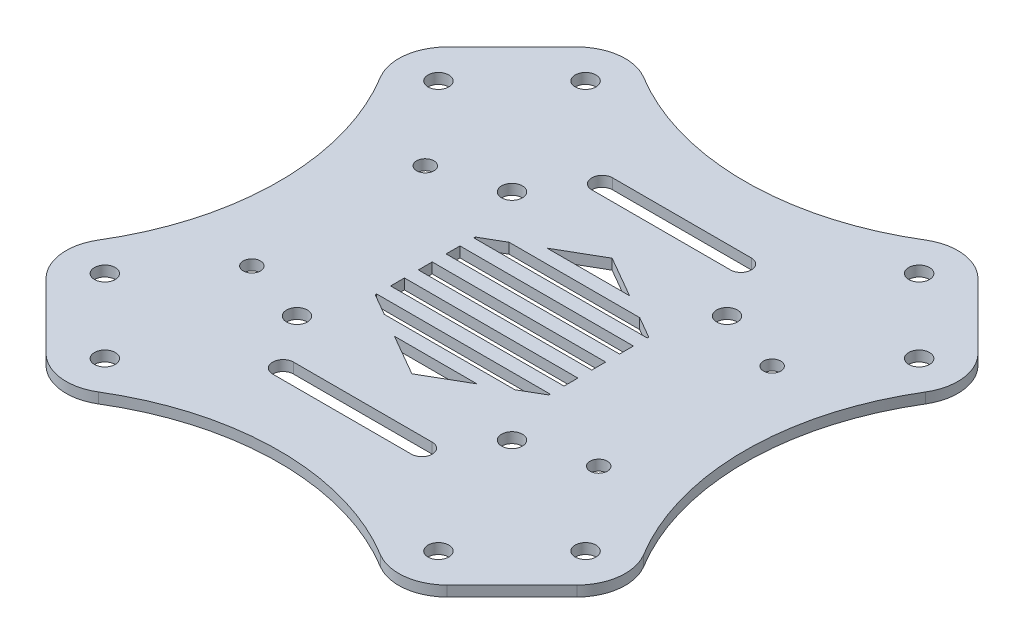
from build123d import *

# Parameters (mm, degrees)
BOSS_EXTRUDE1_DEPTH = 1.5
SKETCH2_R           = 1.5
CUT_EXTRUDE1_DEPTH  = 108.510464607
FILLET1_R           = 7
SKETCH3_R           = 1.5
CUT_EXTRUDE2_DEPTH  = 105.519616835
SKETCH6_R           = 1.25
CUT_EXTRUDE3_DEPTH  = 105.519616835
SKETCH8_W           = 25
SKETCH8_H           = 2
BOSS_EXTRUDE2_DEPTH = 1.5


with BuildPart() as part:
    # Sketch1 → Boss-Extrude1 (new body)
    with BuildSketch(Plane(origin=(0, 0, 0), x_dir=(1, 0, 0), z_dir=(0, 1, 0))):
        with BuildLine():
            Line((76.013978978, 8.838834765), (58.336309448, -8.838834765))
            ThreePointArc((58.336309448, -8.838834765), (33.587572106, 0), (8.838834765, -8.838834765))
            Line((8.838834765, -8.838834765), (-8.838834765, 8.838834765))
            ThreePointArc((-8.838834765, 8.838834765), (0, 33.587572106), (-8.838834765, 58.336309448))
            Line((-8.838834765, 58.336309448), (8.838834765, 76.013978978))
            ThreePointArc((8.838834765, 76.013978978), (33.587572106, 67.175144213), (58.336309448, 76.013978978))
            Line((58.336309448, 76.013978978), (76.013978978, 58.336309448))
            ThreePointArc((76.013978978, 58.336309448), (67.175144213, 33.587572106), (76.013978978, 8.838834765))
        make_face()
    extrude(amount=BOSS_EXTRUDE1_DEPTH)

    # Sketch2 → Cut-Extrude1 (cut, through all)
    with BuildSketch(Plane(origin=(0, 1.5, 0), x_dir=(1, 0, 0), z_dir=(0, 1, 0))):
        with Locations(Location((57.629202667, 68.235804385, 0), (0, 0, 270))):
            Circle(SKETCH2_R)
        with Locations(Location((68.235804385, 57.629202667, 0), (0, 0, 270))):
            Circle(SKETCH2_R)
        with Locations(Location((68.235804385, 9.545941546, 0), (0, 0, 270))):
            Circle(SKETCH2_R)
        with Locations(Location((57.629202667, -1.060660172, 0), (0, 0, 270))):
            Circle(SKETCH2_R)
        with Locations(Location((9.545941546, -1.060660172, 0), (0, 0, 270))):
            Circle(SKETCH2_R)
        with Locations(Location((-1.060660172, 9.545941546, 0), (0, 0, 270))):
            Circle(SKETCH2_R)
        with Locations(Location((-1.060660172, 57.629202667, 0), (0, 0, 270))):
            Circle(SKETCH2_R)
        with Locations(Location((9.545941546, 68.235804385, 0), (0, 0, 270))):
            Circle(SKETCH2_R)
    extrude(amount=-CUT_EXTRUDE1_DEPTH, mode=Mode.SUBTRACT)

    # Fillet1
    fillet1_edges = [part.edges().sort_by_distance(p)[0] for p in [
        (76.013978978, 0.75, -8.838834765),
        (58.336309448, 0.75, 8.838834765),
        (8.838834765, 0.75, 8.838834765),
        (-8.838834765, 0.75, -8.838834765),
        (-8.838834765, 0.75, -58.336309448),
        (8.838834765, 0.75, -76.013978978),
        (58.336309448, 0.75, -76.013978978),
        (76.013978978, 0.75, -58.336309448),
    ]]
    fillet(fillet1_edges, radius=FILLET1_R)

    # Sketch3 → Cut-Extrude2 (cut, through all)
    with BuildSketch(Plane(origin=(0, 1.5, 0), x_dir=(1, 0, 0), z_dir=(0, 1, 0))):
        with Locations(Location((18.087572106, 49.087572106, 0), (0, 0, 270))):
            Circle(SKETCH3_R)
        with Locations(Location((18.087572106, 18.087572106, 0), (0, 0, 270))):
            Circle(SKETCH3_R)
        with Locations(Location((49.087572106, 18.087572106, 0), (0, 0, 90))):
            Circle(SKETCH3_R)
        with Locations(Location((49.087572106, 49.087572106, 0), (0, 0, 90))):
            Circle(SKETCH3_R)
    extrude(amount=-CUT_EXTRUDE2_DEPTH, mode=Mode.SUBTRACT)

    # Sketch6 → Cut-Extrude3 (cut, through all)
    with BuildSketch(Plane(origin=(0, 1.5, 0), x_dir=(1, 0, 0), z_dir=(0, 1, 0))):
        with Locations(Location((58.587572106, 46.087572106, 0), (0, 0, 270))):
            Circle(SKETCH6_R)
        with Locations(Location((58.587572106, 21.087572106, 0), (0, 0, 270))):
            Circle(SKETCH6_R)
        with Locations(Location((8.587572106, 21.087572106, 0), (0, 0, 90))):
            Circle(SKETCH6_R)
        with Locations(Location((8.587572106, 46.087572106, 0), (0, 0, 90))):
            Circle(SKETCH6_R)
        with BuildLine():
            Line((23.587572106, 58.087572106), (43.587572106, 58.087572106))
            ThreePointArc((43.587572106, 58.087572106), (45.087572106, 56.587572106), (43.587572106, 55.087572106))
            Line((43.587572106, 55.087572106), (23.587572106, 55.087572106))
            ThreePointArc((23.587572106, 55.087572106), (22.087572106, 56.587572106), (23.587572106, 58.087572106))
        make_face()
        with BuildLine():
            Line((23.587572106, 9.087572106), (43.587572106, 9.087572106))
            ThreePointArc((43.587572106, 9.087572106), (45.087572106, 10.587572106), (43.587572106, 12.087572106))
            Line((43.587572106, 12.087572106), (23.587572106, 12.087572106))
            ThreePointArc((23.587572106, 12.087572106), (22.087572106, 10.587572106), (23.587572106, 9.087572106))
        make_face()
        Polygon((33.587572106, 48.021328836), (21.087572106, 40.804450471), (21.087572106, 26.370693741), (33.587572106, 19.153815377), (46.087572106, 26.370693741), (46.087572106, 40.804450471), align=None)
    extrude(amount=-CUT_EXTRUDE3_DEPTH, mode=Mode.SUBTRACT)

    # Sketch8 → Boss-Extrude2 (add, through all)
    with BuildSketch(Plane(origin=(0, 1.5, 0), x_dir=(1, 0, 0), z_dir=(0, 1, 0))):
        with Locations((33.587572106, 35.587572106)):
            Rectangle(SKETCH8_W, SKETCH8_H)
        with Locations((33.587572106, 31.587572106)):
            Rectangle(SKETCH8_W, SKETCH8_H)
        with Locations((33.587572106, 39.587572106)):
            Rectangle(SKETCH8_W, SKETCH8_H)
        Polygon((24.176029374, 42.587572106), (42.999114838, 42.587572106), (39.535013223, 44.587572106), (27.64013099, 44.587572106), align=None)
        with Locations((33.587572106, 27.587572106)):
            Rectangle(SKETCH8_W, SKETCH8_H)
        Polygon((39.535013223, 22.587572106), (42.999114838, 24.587572106), (24.176029374, 24.587572106), (27.64013099, 22.587572106), align=None)
    extrude(amount=-BOSS_EXTRUDE2_DEPTH)


solid = part.part
